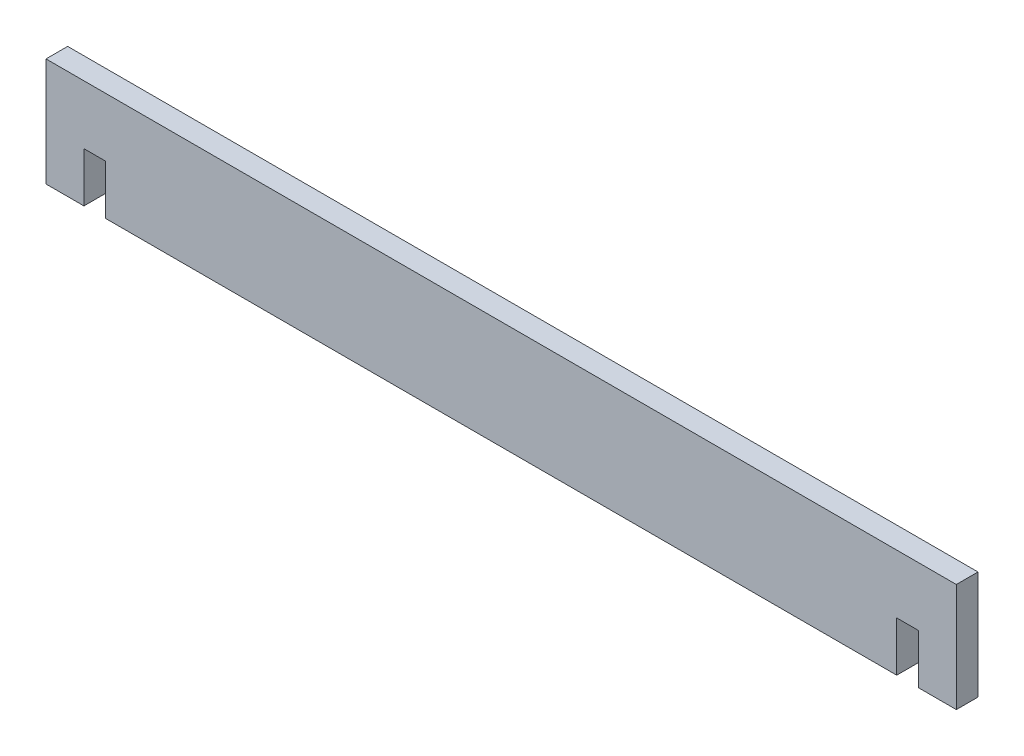
from build123d import *

# Parameters (mm, degrees)
BOSS_EXTRUDE1_DEPTH = 10


with BuildPart() as part:
    # Sketch1 → Boss-Extrude1 (new body)
    with BuildSketch(Plane.XY):
        Polygon((-192.5, -22.889310147), (-192.5, 0), (-182.5, 0), (-182.5, -22.889310147), (182.5, -22.889310147), (182.5, 0), (192.5, 0), (192.5, -22.889310147), (210, -22.889310147), (210, 27.110689853), (-210, 27.110689853), (-210, -22.889310147), align=None)
    extrude(amount=BOSS_EXTRUDE1_DEPTH)


solid = part.part
